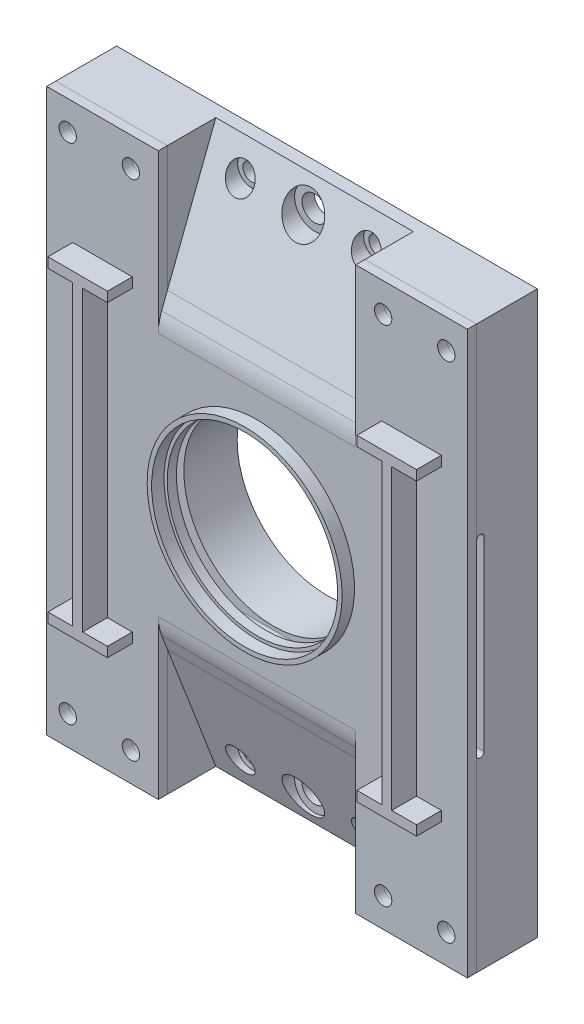
from build123d import *

# Parameters (mm, degrees)
CROQUIS1_R                = 3.5
SALIENTE_EXTRUIR1_DEPTH   = 5
SALIENTE_EXTRUIR1_2_DEPTH = 5
SALIENTE_EXTRUIR1_3_DEPTH = 5
SALIENTE_EXTRUIR1_4_DEPTH = 5
SALIENTE_EXTRUIR1_5_DEPTH = 5
SALIENTE_EXTRUIR1_6_DEPTH = 5
SALIENTE_EXTRUIR1_7_DEPTH = 5
SALIENTE_EXTRUIR1_8_DEPTH = 5
CROQUIS1_W                = 79.6
CROQUIS1_H                = 226.5
CROQUIS1_R_2              = 5.05
CROQUIS1_R_3              = 36.2
SALIENTE_EXTRUIR1_9_DEPTH = 5
CROQUIS2_W                = 79.6
CROQUIS2_H                = 226.5
CROQUIS2_R                = 36.2
CROQUIS2_R_2              = 5.6
CROQUIS2_R_3              = 8.05
SALIENTE_EXTRUIR2_DEPTH   = 23.2
CORTAR_EXTRUIR1_DEPTH     = 80
CORTAR_EXTRUIR3_DEPTH     = 80
REDONDEO1_R               = 20
REDONDEO2_R               = 20
CROQUIS11_W               = 28.2
CROQUIS11_H               = 226.5
SALIENTE_EXTRUIR3_DEPTH   = 45
CROQUIS1_2_R              = 3.5
CORTAR_EXTRUIR7_DEPTH     = 45
CROQUIS13_W               = 28.2
CROQUIS13_H               = 226.5
SALIENTE_EXTRUIR4_DEPTH   = 45
CROQUIS1_3_R              = 3.5
CORTAR_EXTRUIR8_DEPTH     = 45
SALIENTE_EXTRUIR7_DEPTH   = 10
CORTAR_EXTRUIR9_DEPTH     = 125
PARTIR3_SURFACE_1_BACK    = 286.527
PARTIR3_SURFACE_1_DEPTH   = 573.054
PARTIR3_SURFACE_2_BACK    = 286.527
PARTIR3_SURFACE_2_DEPTH   = 573.054
CROQUIS20_R               = 39.3
CROQUIS20_R_2             = 37.5
SALIENTE_EXTRUIR8_DEPTH   = 5


with BuildPart() as part:
    # Croquis1 → Saliente-Extruir1 (new body)
    with BuildSketch(Plane.XY):
        with Locations(Location((-50.85, -101.5, 0), (0, 0, 180))):
            Circle(CROQUIS1_R)
    extrude(amount=SALIENTE_EXTRUIR1_DEPTH)



with BuildPart() as body_2:
    # Croquis1 → Saliente-Extruir1 2 (new body)
    with BuildSketch(Plane.XY):
        with Locations(Location((-76.3, -101.5, 0), (0, 0, 180))):
            Circle(CROQUIS1_R)
    extrude(amount=SALIENTE_EXTRUIR1_2_DEPTH)


with BuildPart() as body_3:
    # Croquis1 → Saliente-Extruir1 3 (new body)
    with BuildSketch(Plane.XY):
        with Locations(Location((50.85, -101.5, 0), (0, 0, 180))):
            Circle(CROQUIS1_R)
    extrude(amount=SALIENTE_EXTRUIR1_3_DEPTH)



with BuildPart() as body_4:
    # Croquis1 → Saliente-Extruir1 4 (new body)
    with BuildSketch(Plane.XY):
        with Locations(Location((76.3, -101.5, 0), (0, 0, 180))):
            Circle(CROQUIS1_R)
    extrude(amount=SALIENTE_EXTRUIR1_4_DEPTH)


with BuildPart() as body_5:
    # Croquis1 → Saliente-Extruir1 5 (new body)
    with BuildSketch(Plane.XY):
        with Locations((-76.3, 101.5)):
            Circle(CROQUIS1_R)
    extrude(amount=SALIENTE_EXTRUIR1_5_DEPTH)


with BuildPart() as body_6:
    # Croquis1 → Saliente-Extruir1 6 (new body)
    with BuildSketch(Plane.XY):
        with Locations((-50.85, 101.5)):
            Circle(CROQUIS1_R)
    extrude(amount=SALIENTE_EXTRUIR1_6_DEPTH)


with BuildPart() as body_7:
    # Croquis1 → Saliente-Extruir1 7 (new body)
    with BuildSketch(Plane.XY):
        with Locations((50.85, 101.5)):
            Circle(CROQUIS1_R)
    extrude(amount=SALIENTE_EXTRUIR1_7_DEPTH)


with BuildPart() as body_8:
    # Croquis1 → Saliente-Extruir1 8 (new body)
    with BuildSketch(Plane.XY):
        with Locations((76.3, 101.5)):
            Circle(CROQUIS1_R)
    extrude(amount=SALIENTE_EXTRUIR1_8_DEPTH)


with BuildPart() as body_9:
    # Croquis1 → Saliente-Extruir1 9 (new body)
    with BuildSketch(Plane.XY):
        Rectangle(CROQUIS1_W, CROQUIS1_H)
        with Locations((0, 101.5)):
            Circle(CROQUIS1_R_2, mode=Mode.SUBTRACT)
        with Locations((-25.4, 101.5)):
            Circle(CROQUIS1_R, mode=Mode.SUBTRACT)
        with Locations(Location((25.4, 101.5, 0), (0, 0, 180))):
            Circle(CROQUIS1_R, mode=Mode.SUBTRACT)
        with Locations((25.4, -101.5)):
            Circle(CROQUIS1_R, mode=Mode.SUBTRACT)
        with Locations(Location((0, -101.5, 0), (0, 0, 180))):
            Circle(CROQUIS1_R_2, mode=Mode.SUBTRACT)
        with Locations(Location((-25.4, -101.5, 0), (0, 0, 180))):
            Circle(CROQUIS1_R, mode=Mode.SUBTRACT)
        Circle(CROQUIS1_R_3, mode=Mode.SUBTRACT)
    extrude(amount=SALIENTE_EXTRUIR1_9_DEPTH)

    # Croquis2 → Saliente-Extruir2 (add)
    with BuildSketch(Plane.XY.offset(5)):
        Rectangle(CROQUIS2_W, CROQUIS2_H)
        Circle(CROQUIS2_R, mode=Mode.SUBTRACT)
        with Locations((-25.4, 101.5)):
            Circle(CROQUIS2_R_2, mode=Mode.SUBTRACT)
        with Locations((0, 101.5)):
            Circle(CROQUIS2_R_3, mode=Mode.SUBTRACT)
        with Locations((25.4, 101.5)):
            Circle(CROQUIS2_R_2, mode=Mode.SUBTRACT)
        with Locations((-25.4, -101.5)):
            Circle(CROQUIS2_R_2, mode=Mode.SUBTRACT)
        with Locations((25.4, -101.5)):
            Circle(CROQUIS2_R_2, mode=Mode.SUBTRACT)
        with Locations((0, -101.5)):
            Circle(CROQUIS2_R_3, mode=Mode.SUBTRACT)
    extrude(amount=SALIENTE_EXTRUIR2_DEPTH)

    # Croquis3 → Cortar-Extruir1 (cut)
    with BuildSketch(Plane(origin=(39.8, 0, 0), x_dir=(0, 0, -1), z_dir=(1, 0, 0))):
        Polygon((-5, -113.25), (-28.2, -113.25), (-28.2, -53.121445122), align=None)
    extrude(amount=-CORTAR_EXTRUIR1_DEPTH, mode=Mode.SUBTRACT)

    # Croquis4 → Cortar-Extruir3 (cut)
    with BuildSketch(Plane(origin=(39.8, 0, 0), x_dir=(0, 0, -1), z_dir=(1, 0, 0))):
        Polygon((-28.2, 113.25), (-5, 113.25), (-28.2, 53.25), align=None)
    extrude(amount=-CORTAR_EXTRUIR3_DEPTH, mode=Mode.SUBTRACT)

    # Redondeo1
    redondeo1_edges = [body_9.edges().sort_by_distance(p)[0] for p in [
        (0, 53.25, 28.2),
    ]]
    fillet(redondeo1_edges, radius=REDONDEO1_R)

    # Redondeo2
    redondeo2_edges = [body_9.edges().sort_by_distance(p)[0] for p in [
        (0, -53.121445122, 28.2),
    ]]
    fillet(redondeo2_edges, radius=REDONDEO2_R)


with BuildPart() as body_3_1:
    add(body_3.part)

    add(body_4.part)  # Saliente-Extruir3 merges body 4

    add(body_7.part)  # Saliente-Extruir3 merges body 7

    add(body_8.part)  # Saliente-Extruir3 merges body 8

    add(body_9.part)  # Saliente-Extruir3 merges body 9
    # Croquis11 → Saliente-Extruir3 (add)
    with BuildSketch(Plane(origin=(39.8, 0, 0), x_dir=(0, 0, -1), z_dir=(1, 0, 0))):
        with Locations((-14.1, 0)):
            Rectangle(CROQUIS11_W, CROQUIS11_H)
    extrude(amount=SALIENTE_EXTRUIR3_DEPTH)

    # Croquis1<2> → Cortar-Extruir7 (cut)
    with BuildSketch(Plane.XY):
        with Locations(Location((50.85, -101.5, 0), (0, 0, 180))):
            Circle(CROQUIS1_2_R)
        with Locations(Location((76.3, -101.5, 0), (0, 0, 180))):
            Circle(CROQUIS1_2_R)
        with Locations(Location((50.85, 101.5, 0), (0, 0, 180))):
            Circle(CROQUIS1_2_R)
        with Locations(Location((76.3, 101.5, 0), (0, 0, 180))):
            Circle(CROQUIS1_2_R)
    extrude(amount=CORTAR_EXTRUIR7_DEPTH, mode=Mode.SUBTRACT)


with BuildPart() as part_1:
    add(part.part)

    add(body_2.part)  # Saliente-Extruir4 merges body 2

    add(body_3_1.part)  # Saliente-Extruir4 merges body 3

    add(body_5.part)  # Saliente-Extruir4 merges body 5

    add(body_6.part)  # Saliente-Extruir4 merges body 6
    # Croquis13 → Saliente-Extruir4 (add)
    with BuildSketch(Plane.ZY.offset(39.8)):
        with Locations((14.1, 0)):
            Rectangle(CROQUIS13_W, CROQUIS13_H)
    extrude(amount=SALIENTE_EXTRUIR4_DEPTH)

    # Croquis1<3> → Cortar-Extruir8 (cut)
    with BuildSketch(Plane.XY):
        with Locations(Location((-50.85, -101.5, 0), (0, 0, 180))):
            Circle(CROQUIS1_3_R)
        with Locations(Location((-76.3, -101.5, 0), (0, 0, 180))):
            Circle(CROQUIS1_3_R)
        with Locations(Location((-76.3, 101.5, 0), (0, 0, 180))):
            Circle(CROQUIS1_3_R)
        with Locations(Location((-50.85, 101.5, 0), (0, 0, 180))):
            Circle(CROQUIS1_3_R)
    extrude(amount=CORTAR_EXTRUIR8_DEPTH, mode=Mode.SUBTRACT)

    # Croquis21 → Saliente-Extruir7 (add)
    with BuildSketch(Plane.XY.offset(28.2)):
        Polygon((-64.3, -60), (-74.3, -60), (-74.3, -64), (-64.3, -64), (-50.3, -64), (-50.3, -60), (-60.3, -60), (-60.3, 60), (-50.3, 60), (-50.3, 64), (-74.3, 64), (-74.3, 60), (-64.3, 60), align=None)
        Polygon((50.3, 64), (50.3, 60), (60.3, 60), (60.3, -60), (50.3, -60), (50.3, -64), (64.3, -64), (74.3, -64), (74.3, -60), (64.3, -60), (64.3, 60), (74.3, 60), (74.3, 64), align=None)
    extrude(amount=SALIENTE_EXTRUIR7_DEPTH)

    # Croquis22 → Cortar-Extruir9 (cut)
    with BuildSketch(Plane(origin=(84.8, 0, 0), x_dir=(0, 0, -1), z_dir=(1, 0, 0))):
        with BuildLine():
            Line((-24.52, -37.5), (-24.52, 37.5))
            ThreePointArc((-24.52, 37.5), (-23.02, 39), (-21.52, 37.5))
            Line((-21.52, 37.5), (-21.52, -37.5))
            ThreePointArc((-21.52, -37.5), (-23.02, -39), (-24.52, -37.5))
        make_face()
    extrude(amount=-CORTAR_EXTRUIR9_DEPTH, mode=Mode.SUBTRACT)


with BuildPart() as body_2_2:
    # Partir3: the piece behind the surface
    add(part_1.part)
    # Partir3 surface: a surface, the sketch's curves swept straight by 573.054 mm
    with BuildLine(Plane(origin=(84.8, 0, 0), x_dir=(0, 0, -1), z_dir=(1, 0, 0)).offset(-PARTIR3_SURFACE_1_BACK), mode=Mode.PRIVATE) as partir3_surface_1_path:
        Line((-24.52, -120), (-24.52, 0))
        Line((-24.52, 0), (-24.52, 124.107355669))
    partir3_surface_1 = Shell.extrude(partir3_surface_1_path.wire(), (1 * PARTIR3_SURFACE_1_DEPTH, 0 * PARTIR3_SURFACE_1_DEPTH, 0 * PARTIR3_SURFACE_1_DEPTH))
    split(bisect_by=partir3_surface_1, keep=Keep.BOTTOM)


with BuildPart() as part_2:
    add(part_1.part)

    # Partir3: split by a surface, the side it looks to stays
    # Partir3 surface: a surface, the sketch's curves swept straight by 573.054 mm
    with BuildLine(Plane(origin=(84.8, 0, 0), x_dir=(0, 0, -1), z_dir=(1, 0, 0)).offset(-PARTIR3_SURFACE_2_BACK), mode=Mode.PRIVATE) as partir3_surface_2_path:
        Line((-24.52, -120), (-24.52, 0))
        Line((-24.52, 0), (-24.52, 124.107355669))
    partir3_surface_2 = Shell.extrude(partir3_surface_2_path.wire(), (1 * PARTIR3_SURFACE_2_DEPTH, 0 * PARTIR3_SURFACE_2_DEPTH, 0 * PARTIR3_SURFACE_2_DEPTH))
    split(bisect_by=partir3_surface_2, keep=Keep.TOP)

    # Croquis20 → Saliente-Extruir8 (add)
    with BuildSketch(Plane.XY.offset(28.2)):
        with Locations(Location((0, 0, 0), (0, 0, 180))):
            Circle(CROQUIS20_R)
        Circle(CROQUIS20_R_2, mode=Mode.SUBTRACT)
    extrude(amount=SALIENTE_EXTRUIR8_DEPTH)


solid = Compound([body_2_2.part, part_2.part])
